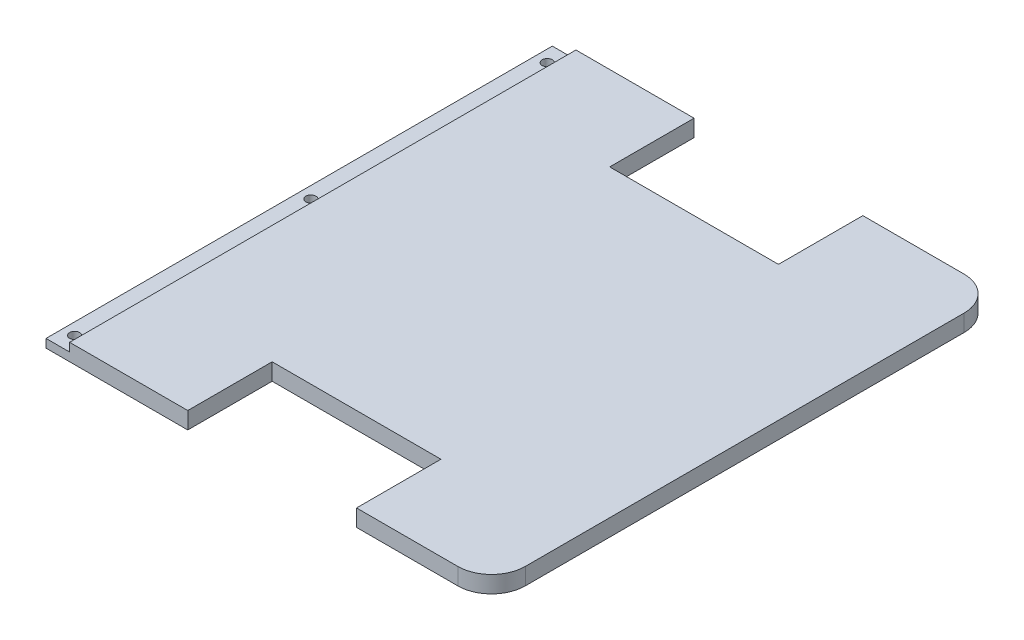
from build123d import *

# Parameters (mm, degrees)
BOSS_EXTRUDE1_DEPTH = 5
CUT_EXTRUDE1_DEPTH  = 150
SKETCH3_R           = 1.5
CUT_EXTRUDE2_DEPTH  = 140.401680724


with BuildPart() as part:
    # Sketch1 → Boss-Extrude1 (new body)
    with BuildSketch(Plane(origin=(0, 0, 0), x_dir=(1, 0, 0), z_dir=(0, 1, 0))):
        with BuildLine():
            Line((64.270386266, 57.510729614), (94.270386266, 57.510729614))
            ThreePointArc((94.270386266, 57.510729614), (101.341454078, 54.581797426), (104.270386266, 47.510729614))
            Line((104.270386266, 47.510729614), (104.270386266, -82.489270386))
            ThreePointArc((104.270386266, -82.489270386), (101.341454078, -89.560338198), (94.270386266, -92.489270386))
            Line((94.270386266, -92.489270386), (64.270386266, -92.489270386))
            Line((64.270386266, -92.489270386), (64.270386266, -67.489270386))
            Line((64.270386266, -67.489270386), (14.270386266, -67.489270386))
            Line((14.270386266, -67.489270386), (14.270386266, -92.489270386))
            Line((14.270386266, -92.489270386), (-55.729613734, -92.489270386))
            Line((-55.729613734, -92.489270386), (-55.729613734, -67.489270386))
            Line((-55.729613734, -67.489270386), (-105.729613734, -67.489270386))
            Line((-105.729613734, -67.489270386), (-105.729613734, -92.489270386))
            Line((-105.729613734, -92.489270386), (-135.729613734, -92.489270386))
            ThreePointArc((-135.729613734, -92.489270386), (-142.800681546, -89.560338198), (-145.729613734, -82.489270386))
            Line((-145.729613734, -82.489270386), (-145.729613734, 47.510729614))
            ThreePointArc((-145.729613734, 47.510729614), (-142.800681546, 54.581797426), (-135.729613734, 57.510729614))
            Line((-135.729613734, 57.510729614), (-105.729613734, 57.510729614))
            Line((-105.729613734, 57.510729614), (-105.729613734, 32.510729614))
            Line((-105.729613734, 32.510729614), (-55.729613734, 32.510729614))
            Line((-55.729613734, 32.510729614), (-55.729613734, 57.510729614))
            Line((-55.729613734, 57.510729614), (14.270386266, 57.510729614))
            Line((14.270386266, 57.510729614), (14.270386266, 32.510729614))
            Line((14.270386266, 32.510729614), (64.270386266, 32.510729614))
            Line((64.270386266, 32.510729614), (64.270386266, 57.510729614))
        make_face()
    extrude(amount=BOSS_EXTRUDE1_DEPTH)

    # Sketch2 → Cut-Extrude1 (cut)
    with BuildSketch(Plane(origin=(0, 0, -57.510729614), x_dir=(-1, 0, 0), z_dir=(0, 0, -1))):
        Polygon((20.729613734, 2.5), (20.729613734, 5), (55.729613734, 5), (105.729613734, 5), (135.729613734, 5), (145.729613734, 5), (145.729613734, 0), (135.729613734, 0), (105.729613734, 0), (55.729613734, 0), (27.729613734, 0), (27.729613734, 2.5), align=None)
    extrude(amount=-CUT_EXTRUDE1_DEPTH, mode=Mode.SUBTRACT)

    # Sketch3 → Cut-Extrude2 (cut, through all)
    with BuildSketch(Plane(origin=(0, 2.5, 0), x_dir=(1, 0, 0), z_dir=(0, 1, 0))):
        with Locations(Location((-24.229613734, -17.489270386, 0), (0, 0, 270))):
            Circle(SKETCH3_R)
        with Locations(Location((-24.229613734, 52.510729614, 0), (0, 0, 270))):
            Circle(SKETCH3_R)
        with Locations(Location((-24.229613734, -87.489270386, 0), (0, 0, 270))):
            Circle(SKETCH3_R)
    extrude(amount=-CUT_EXTRUDE2_DEPTH, mode=Mode.SUBTRACT)


solid = part.part
